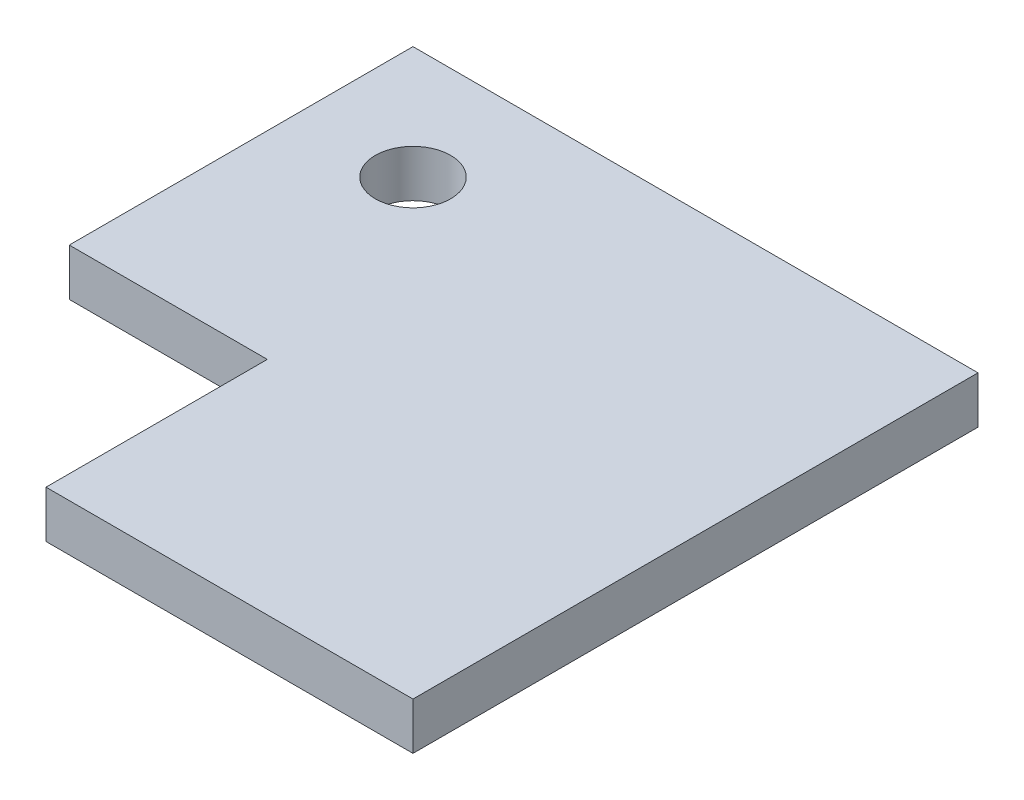
from build123d import *

# Parameters (mm, degrees)
SKETCH_1_W          = 60
SKETCH_1_H          = 60
SKETCH_1_R          = 4
EXTRUDE_1_DEPTH     = 5
SKETCH_2_W          = 21.03
SKETCH_2_H          = 23.5
CUT_EXTRUDE_1_DEPTH = 86


with BuildPart() as part:
    # 草图1 → 凸台-拉伸1 (new body)
    with BuildSketch(Plane(origin=(0, 0, 0), x_dir=(1, 0, 0), z_dir=(0, 1, 0))):
        with Locations((30, -30)):
            Rectangle(SKETCH_1_W, SKETCH_1_H)
        with Locations(Location((12, -12, 0), (0, 0, 270))):
            Circle(SKETCH_1_R, mode=Mode.SUBTRACT)
    extrude(amount=EXTRUDE_1_DEPTH)

    # 草图2 → 切除-拉伸1 (cut, through all)
    with BuildSketch(Plane(origin=(0, 0, 0), x_dir=(1, 0, 0), z_dir=(0, 1, 0))):
        with Locations((10.515, -48.25)):
            Rectangle(SKETCH_2_W, SKETCH_2_H)
    extrude(amount=CUT_EXTRUDE_1_DEPTH, mode=Mode.SUBTRACT)


solid = part.part
